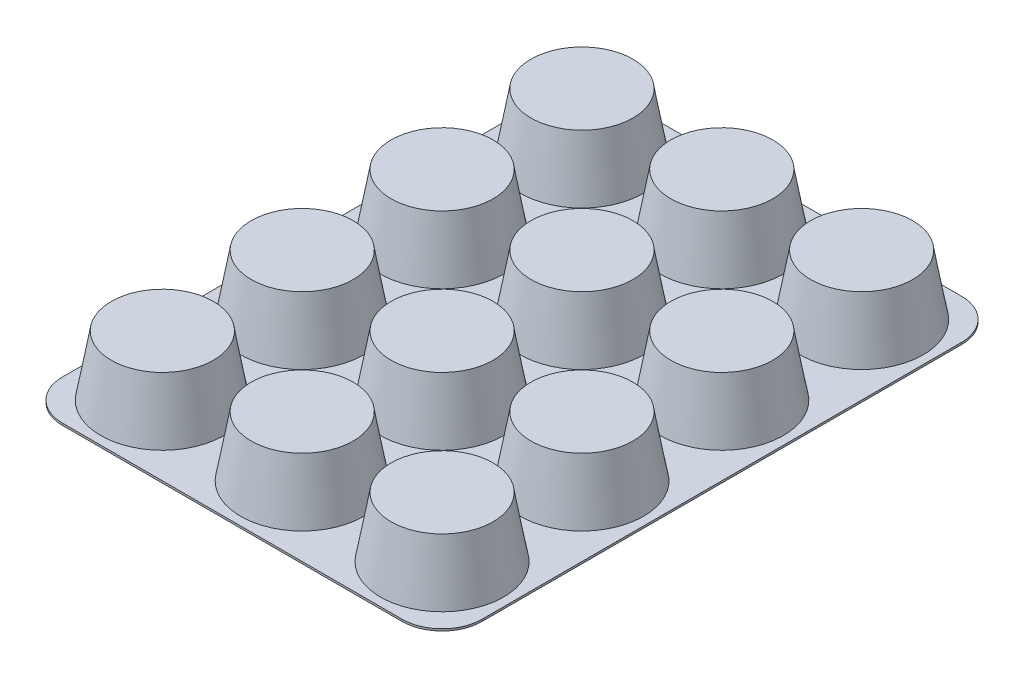
from build123d import *

# Parameters (mm, degrees)
SKETCH2_W                  = 266.7
SKETCH2_H                  = 355.6
BOSS_EXTRUDE1_DEPTH        = 1.27
SKETCH3_R                  = 39.37
BOSS_EXTRUDE2_DEPTH        = 39.37
BOSS_EXTRUDE2_DRAFT        = -10
SKETCH4_R                  = 38.1
CUT_EXTRUDE1_DEPTH         = 38.1
CUT_EXTRUDE1_DRAFT         = -10
LPATTERN3_COPY_1_SKETCH_R  = 39.37
LPATTERN3_COPY_1_DEPTH     = 39.37
LPATTERN3_COPY_1_DRAFT     = -10
LPATTERN3_COPY_2_SKETCH_R  = 39.37
LPATTERN3_COPY_2_DEPTH     = 39.37
LPATTERN3_COPY_2_DRAFT     = -10
LPATTERN3_COPY_3_SKETCH_R  = 39.37
LPATTERN3_COPY_3_DEPTH     = 39.37
LPATTERN3_COPY_3_DRAFT     = -10
LPATTERN3_COPY_4_SKETCH_R  = 39.37
LPATTERN3_COPY_4_DEPTH     = 39.37
LPATTERN3_COPY_4_DRAFT     = -10
LPATTERN3_COPY_5_SKETCH_R  = 39.37
LPATTERN3_COPY_5_DEPTH     = 39.37
LPATTERN3_COPY_5_DRAFT     = -10
LPATTERN3_COPY_6_SKETCH_R  = 39.37
LPATTERN3_COPY_6_DEPTH     = 39.37
LPATTERN3_COPY_6_DRAFT     = -10
LPATTERN3_COPY_7_SKETCH_R  = 39.37
LPATTERN3_COPY_7_DEPTH     = 39.37
LPATTERN3_COPY_7_DRAFT     = -10
LPATTERN3_COPY_8_SKETCH_R  = 39.37
LPATTERN3_COPY_8_DEPTH     = 39.37
LPATTERN3_COPY_8_DRAFT     = -10
LPATTERN3_COPY_9_SKETCH_R  = 39.37
LPATTERN3_COPY_9_DEPTH     = 39.37
LPATTERN3_COPY_9_DRAFT     = -10
LPATTERN3_COPY_10_SKETCH_R = 39.37
LPATTERN3_COPY_10_DEPTH    = 39.37
LPATTERN3_COPY_10_DRAFT    = -10
LPATTERN3_COPY_11_SKETCH_R = 39.37
LPATTERN3_COPY_11_DEPTH    = 39.37
LPATTERN3_COPY_11_DRAFT    = -10
LPATTERN3_COPY_12_SKETCH_R = 38.1
LPATTERN3_COPY_12_DEPTH    = 38.1
LPATTERN3_COPY_12_DRAFT    = -10
LPATTERN3_COPY_13_SKETCH_R = 38.1
LPATTERN3_COPY_13_DEPTH    = 38.1
LPATTERN3_COPY_13_DRAFT    = -10
LPATTERN3_COPY_14_SKETCH_R = 38.1
LPATTERN3_COPY_14_DEPTH    = 38.1
LPATTERN3_COPY_14_DRAFT    = -10
LPATTERN3_COPY_15_SKETCH_R = 38.1
LPATTERN3_COPY_15_DEPTH    = 38.1
LPATTERN3_COPY_15_DRAFT    = -10
LPATTERN3_COPY_16_SKETCH_R = 38.1
LPATTERN3_COPY_16_DEPTH    = 38.1
LPATTERN3_COPY_16_DRAFT    = -10
LPATTERN3_COPY_17_SKETCH_R = 38.1
LPATTERN3_COPY_17_DEPTH    = 38.1
LPATTERN3_COPY_17_DRAFT    = -10
LPATTERN3_COPY_18_SKETCH_R = 38.1
LPATTERN3_COPY_18_DEPTH    = 38.1
LPATTERN3_COPY_18_DRAFT    = -10
LPATTERN3_COPY_19_SKETCH_R = 38.1
LPATTERN3_COPY_19_DEPTH    = 38.1
LPATTERN3_COPY_19_DRAFT    = -10
LPATTERN3_COPY_20_SKETCH_R = 38.1
LPATTERN3_COPY_20_DEPTH    = 38.1
LPATTERN3_COPY_20_DRAFT    = -10
LPATTERN3_COPY_21_SKETCH_R = 38.1
LPATTERN3_COPY_21_DEPTH    = 38.1
LPATTERN3_COPY_21_DRAFT    = -10
LPATTERN3_COPY_22_SKETCH_R = 38.1
LPATTERN3_COPY_22_DEPTH    = 38.1
LPATTERN3_COPY_22_DRAFT    = -10
FILLET1_R                  = 25.4


with BuildPart() as part:
    # Sketch2 → Boss-Extrude1 (new body)
    with BuildSketch(Plane(origin=(0, 0, 0), x_dir=(1, 0, 0), z_dir=(0, 1, 0))):
        Rectangle(SKETCH2_W, SKETCH2_H)
    extrude(amount=BOSS_EXTRUDE1_DEPTH)


with BuildPart() as boss_extrude2_tool:
    # Sketch3 → Boss-Extrude2 (with draft: the straight prism first)
    with BuildSketch(Plane(origin=(0, 0, 0), x_dir=(-1, 0, 0), z_dir=(0, -1, 0))):
        with Locations((88.9, -133.35)):
            Circle(SKETCH3_R)
    extrude(amount=-BOSS_EXTRUDE2_DEPTH)
    # Boss-Extrude2: the draft: its side faces are tilted about the plane it starts from
    boss_extrude2_sides = [boss_extrude2_tool.faces().sort_by_distance(p)[0] for p in [
        (-49.53, 19.685, 133.35),
    ]]
    draft(boss_extrude2_sides, Plane(origin=(0, 0, 0), x_dir=(-1, 0, 0), z_dir=(0, -1, 0)), BOSS_EXTRUDE2_DRAFT)


with BuildPart() as part_1:
    add(part.part)

    # Boss-Extrude2: add boss_extrude2_tool
    add(boss_extrude2_tool.part)


with BuildPart() as cut_extrude1_tool:
    # Sketch4 → Cut-Extrude1 (with draft: the straight prism first)
    with BuildSketch(Plane(origin=(0, 0, 0), x_dir=(-1, 0, 0), z_dir=(0, -1, 0))):
        with Locations((88.9, -133.35)):
            Circle(SKETCH4_R)
    extrude(amount=-CUT_EXTRUDE1_DEPTH)
    # Cut-Extrude1: the draft: its side faces are tilted about the plane it starts from
    cut_extrude1_sides = [cut_extrude1_tool.faces().sort_by_distance(p)[0] for p in [
        (-50.8, 19.05, 133.35),
    ]]
    draft(cut_extrude1_sides, Plane(origin=(0, 0, 0), x_dir=(-1, 0, 0), z_dir=(0, -1, 0)), CUT_EXTRUDE1_DRAFT)


with BuildPart() as part_2:
    add(part_1.part)

    # Cut-Extrude1: cut by cut_extrude1_tool
    add(cut_extrude1_tool.part, mode=Mode.SUBTRACT)


with BuildPart() as lpattern3_copy_1_tool:
    # LPattern3 copy 1 sketch → LPattern3 copy 1 (with draft: the straight prism first)
    with BuildSketch(Plane(origin=(0, 0, -88.9), x_dir=(-1, 0, 0), z_dir=(0, -1, 0))):
        with Locations((88.9, -133.35)):
            Circle(LPATTERN3_COPY_1_SKETCH_R)
    extrude(amount=-LPATTERN3_COPY_1_DEPTH)
    # LPattern3 copy 1: the draft: its side faces are tilted about the plane it starts from
    lpattern3_copy_1_sides = [lpattern3_copy_1_tool.faces().sort_by_distance(p)[0] for p in [
        (-49.53, 19.685, 44.45),
    ]]
    draft(lpattern3_copy_1_sides, Plane(origin=(0, 0, -88.9), x_dir=(-1, 0, 0), z_dir=(0, -1, 0)), LPATTERN3_COPY_1_DRAFT)


with BuildPart() as part_3:
    add(part_2.part)

    # LPattern3 copy 1: add lpattern3_copy_1_tool
    add(lpattern3_copy_1_tool.part)


with BuildPart() as lpattern3_copy_2_tool:
    # LPattern3 copy 2 sketch → LPattern3 copy 2 (with draft: the straight prism first)
    with BuildSketch(Plane(origin=(0, 0, -177.8), x_dir=(-1, 0, 0), z_dir=(0, -1, 0))):
        with Locations((88.9, -133.35)):
            Circle(LPATTERN3_COPY_2_SKETCH_R)
    extrude(amount=-LPATTERN3_COPY_2_DEPTH)
    # LPattern3 copy 2: the draft: its side faces are tilted about the plane it starts from
    lpattern3_copy_2_sides = [lpattern3_copy_2_tool.faces().sort_by_distance(p)[0] for p in [
        (-49.53, 19.685, -44.45),
    ]]
    draft(lpattern3_copy_2_sides, Plane(origin=(0, 0, -177.8), x_dir=(-1, 0, 0), z_dir=(0, -1, 0)), LPATTERN3_COPY_2_DRAFT)


with BuildPart() as part_4:
    add(part_3.part)

    # LPattern3 copy 2: add lpattern3_copy_2_tool
    add(lpattern3_copy_2_tool.part)


with BuildPart() as lpattern3_copy_3_tool:
    # LPattern3 copy 3 sketch → LPattern3 copy 3 (with draft: the straight prism first)
    with BuildSketch(Plane(origin=(0, 0, -266.7), x_dir=(-1, 0, 0), z_dir=(0, -1, 0))):
        with Locations((88.9, -133.35)):
            Circle(LPATTERN3_COPY_3_SKETCH_R)
    extrude(amount=-LPATTERN3_COPY_3_DEPTH)
    # LPattern3 copy 3: the draft: its side faces are tilted about the plane it starts from
    lpattern3_copy_3_sides = [lpattern3_copy_3_tool.faces().sort_by_distance(p)[0] for p in [
        (-49.53, 19.685, -133.35),
    ]]
    draft(lpattern3_copy_3_sides, Plane(origin=(0, 0, -266.7), x_dir=(-1, 0, 0), z_dir=(0, -1, 0)), LPATTERN3_COPY_3_DRAFT)


with BuildPart() as part_5:
    add(part_4.part)

    # LPattern3 copy 3: add lpattern3_copy_3_tool
    add(lpattern3_copy_3_tool.part)


with BuildPart() as lpattern3_copy_4_tool:
    # LPattern3 copy 4 sketch → LPattern3 copy 4 (with draft: the straight prism first)
    with BuildSketch(Plane(origin=(88.9, 0, 0), x_dir=(-1, 0, 0), z_dir=(0, -1, 0))):
        with Locations((88.9, -133.35)):
            Circle(LPATTERN3_COPY_4_SKETCH_R)
    extrude(amount=-LPATTERN3_COPY_4_DEPTH)
    # LPattern3 copy 4: the draft: its side faces are tilted about the plane it starts from
    lpattern3_copy_4_sides = [lpattern3_copy_4_tool.faces().sort_by_distance(p)[0] for p in [
        (39.37, 19.685, 133.35),
    ]]
    draft(lpattern3_copy_4_sides, Plane(origin=(88.9, 0, 0), x_dir=(-1, 0, 0), z_dir=(0, -1, 0)), LPATTERN3_COPY_4_DRAFT)


with BuildPart() as part_6:
    add(part_5.part)

    # LPattern3 copy 4: add lpattern3_copy_4_tool
    add(lpattern3_copy_4_tool.part)


with BuildPart() as lpattern3_copy_5_tool:
    # LPattern3 copy 5 sketch → LPattern3 copy 5 (with draft: the straight prism first)
    with BuildSketch(Plane(origin=(88.9, 0, -88.9), x_dir=(-1, 0, 0), z_dir=(0, -1, 0))):
        with Locations((88.9, -133.35)):
            Circle(LPATTERN3_COPY_5_SKETCH_R)
    extrude(amount=-LPATTERN3_COPY_5_DEPTH)
    # LPattern3 copy 5: the draft: its side faces are tilted about the plane it starts from
    lpattern3_copy_5_sides = [lpattern3_copy_5_tool.faces().sort_by_distance(p)[0] for p in [
        (39.37, 19.685, 44.45),
    ]]
    draft(lpattern3_copy_5_sides, Plane(origin=(88.9, 0, -88.9), x_dir=(-1, 0, 0), z_dir=(0, -1, 0)), LPATTERN3_COPY_5_DRAFT)


with BuildPart() as part_7:
    add(part_6.part)

    # LPattern3 copy 5: add lpattern3_copy_5_tool
    add(lpattern3_copy_5_tool.part)


with BuildPart() as lpattern3_copy_6_tool:
    # LPattern3 copy 6 sketch → LPattern3 copy 6 (with draft: the straight prism first)
    with BuildSketch(Plane(origin=(88.9, 0, -177.8), x_dir=(-1, 0, 0), z_dir=(0, -1, 0))):
        with Locations((88.9, -133.35)):
            Circle(LPATTERN3_COPY_6_SKETCH_R)
    extrude(amount=-LPATTERN3_COPY_6_DEPTH)
    # LPattern3 copy 6: the draft: its side faces are tilted about the plane it starts from
    lpattern3_copy_6_sides = [lpattern3_copy_6_tool.faces().sort_by_distance(p)[0] for p in [
        (39.37, 19.685, -44.45),
    ]]
    draft(lpattern3_copy_6_sides, Plane(origin=(88.9, 0, -177.8), x_dir=(-1, 0, 0), z_dir=(0, -1, 0)), LPATTERN3_COPY_6_DRAFT)


with BuildPart() as part_8:
    add(part_7.part)

    # LPattern3 copy 6: add lpattern3_copy_6_tool
    add(lpattern3_copy_6_tool.part)


with BuildPart() as lpattern3_copy_7_tool:
    # LPattern3 copy 7 sketch → LPattern3 copy 7 (with draft: the straight prism first)
    with BuildSketch(Plane(origin=(88.9, 0, -266.7), x_dir=(-1, 0, 0), z_dir=(0, -1, 0))):
        with Locations((88.9, -133.35)):
            Circle(LPATTERN3_COPY_7_SKETCH_R)
    extrude(amount=-LPATTERN3_COPY_7_DEPTH)
    # LPattern3 copy 7: the draft: its side faces are tilted about the plane it starts from
    lpattern3_copy_7_sides = [lpattern3_copy_7_tool.faces().sort_by_distance(p)[0] for p in [
        (39.37, 19.685, -133.35),
    ]]
    draft(lpattern3_copy_7_sides, Plane(origin=(88.9, 0, -266.7), x_dir=(-1, 0, 0), z_dir=(0, -1, 0)), LPATTERN3_COPY_7_DRAFT)


with BuildPart() as part_9:
    add(part_8.part)

    # LPattern3 copy 7: add lpattern3_copy_7_tool
    add(lpattern3_copy_7_tool.part)


with BuildPart() as lpattern3_copy_8_tool:
    # LPattern3 copy 8 sketch → LPattern3 copy 8 (with draft: the straight prism first)
    with BuildSketch(Plane(origin=(177.8, 0, 0), x_dir=(-1, 0, 0), z_dir=(0, -1, 0))):
        with Locations((88.9, -133.35)):
            Circle(LPATTERN3_COPY_8_SKETCH_R)
    extrude(amount=-LPATTERN3_COPY_8_DEPTH)
    # LPattern3 copy 8: the draft: its side faces are tilted about the plane it starts from
    lpattern3_copy_8_sides = [lpattern3_copy_8_tool.faces().sort_by_distance(p)[0] for p in [
        (128.27, 19.685, 133.35),
    ]]
    draft(lpattern3_copy_8_sides, Plane(origin=(177.8, 0, 0), x_dir=(-1, 0, 0), z_dir=(0, -1, 0)), LPATTERN3_COPY_8_DRAFT)


with BuildPart() as part_10:
    add(part_9.part)

    # LPattern3 copy 8: add lpattern3_copy_8_tool
    add(lpattern3_copy_8_tool.part)


with BuildPart() as lpattern3_copy_9_tool:
    # LPattern3 copy 9 sketch → LPattern3 copy 9 (with draft: the straight prism first)
    with BuildSketch(Plane(origin=(177.8, 0, -88.9), x_dir=(-1, 0, 0), z_dir=(0, -1, 0))):
        with Locations((88.9, -133.35)):
            Circle(LPATTERN3_COPY_9_SKETCH_R)
    extrude(amount=-LPATTERN3_COPY_9_DEPTH)
    # LPattern3 copy 9: the draft: its side faces are tilted about the plane it starts from
    lpattern3_copy_9_sides = [lpattern3_copy_9_tool.faces().sort_by_distance(p)[0] for p in [
        (128.27, 19.685, 44.45),
    ]]
    draft(lpattern3_copy_9_sides, Plane(origin=(177.8, 0, -88.9), x_dir=(-1, 0, 0), z_dir=(0, -1, 0)), LPATTERN3_COPY_9_DRAFT)


with BuildPart() as part_11:
    add(part_10.part)

    # LPattern3 copy 9: add lpattern3_copy_9_tool
    add(lpattern3_copy_9_tool.part)


with BuildPart() as lpattern3_copy_10_tool:
    # LPattern3 copy 10 sketch → LPattern3 copy 10 (with draft: the straight prism first)
    with BuildSketch(Plane(origin=(177.8, 0, -177.8), x_dir=(-1, 0, 0), z_dir=(0, -1, 0))):
        with Locations((88.9, -133.35)):
            Circle(LPATTERN3_COPY_10_SKETCH_R)
    extrude(amount=-LPATTERN3_COPY_10_DEPTH)
    # LPattern3 copy 10: the draft: its side faces are tilted about the plane it starts from
    lpattern3_copy_10_sides = [lpattern3_copy_10_tool.faces().sort_by_distance(p)[0] for p in [
        (128.27, 19.685, -44.45),
    ]]
    draft(lpattern3_copy_10_sides, Plane(origin=(177.8, 0, -177.8), x_dir=(-1, 0, 0), z_dir=(0, -1, 0)), LPATTERN3_COPY_10_DRAFT)


with BuildPart() as part_12:
    add(part_11.part)

    # LPattern3 copy 10: add lpattern3_copy_10_tool
    add(lpattern3_copy_10_tool.part)


with BuildPart() as lpattern3_copy_11_tool:
    # LPattern3 copy 11 sketch → LPattern3 copy 11 (with draft: the straight prism first)
    with BuildSketch(Plane(origin=(177.8, 0, -266.7), x_dir=(-1, 0, 0), z_dir=(0, -1, 0))):
        with Locations((88.9, -133.35)):
            Circle(LPATTERN3_COPY_11_SKETCH_R)
    extrude(amount=-LPATTERN3_COPY_11_DEPTH)
    # LPattern3 copy 11: the draft: its side faces are tilted about the plane it starts from
    lpattern3_copy_11_sides = [lpattern3_copy_11_tool.faces().sort_by_distance(p)[0] for p in [
        (128.27, 19.685, -133.35),
    ]]
    draft(lpattern3_copy_11_sides, Plane(origin=(177.8, 0, -266.7), x_dir=(-1, 0, 0), z_dir=(0, -1, 0)), LPATTERN3_COPY_11_DRAFT)


with BuildPart() as part_13:
    add(part_12.part)

    # LPattern3 copy 11: add lpattern3_copy_11_tool
    add(lpattern3_copy_11_tool.part)


with BuildPart() as lpattern3_copy_12_tool:
    # LPattern3 copy 12 sketch → LPattern3 copy 12 (with draft: the straight prism first)
    with BuildSketch(Plane(origin=(0, 0, -88.9), x_dir=(-1, 0, 0), z_dir=(0, -1, 0))):
        with Locations((88.9, -133.35)):
            Circle(LPATTERN3_COPY_12_SKETCH_R)
    extrude(amount=-LPATTERN3_COPY_12_DEPTH)
    # LPattern3 copy 12: the draft: its side faces are tilted about the plane it starts from
    lpattern3_copy_12_sides = [lpattern3_copy_12_tool.faces().sort_by_distance(p)[0] for p in [
        (-50.8, 19.05, 44.45),
    ]]
    draft(lpattern3_copy_12_sides, Plane(origin=(0, 0, -88.9), x_dir=(-1, 0, 0), z_dir=(0, -1, 0)), LPATTERN3_COPY_12_DRAFT)


with BuildPart() as part_14:
    add(part_13.part)

    # LPattern3 copy 12: cut by lpattern3_copy_12_tool
    add(lpattern3_copy_12_tool.part, mode=Mode.SUBTRACT)


with BuildPart() as lpattern3_copy_13_tool:
    # LPattern3 copy 13 sketch → LPattern3 copy 13 (with draft: the straight prism first)
    with BuildSketch(Plane(origin=(0, 0, -177.8), x_dir=(-1, 0, 0), z_dir=(0, -1, 0))):
        with Locations((88.9, -133.35)):
            Circle(LPATTERN3_COPY_13_SKETCH_R)
    extrude(amount=-LPATTERN3_COPY_13_DEPTH)
    # LPattern3 copy 13: the draft: its side faces are tilted about the plane it starts from
    lpattern3_copy_13_sides = [lpattern3_copy_13_tool.faces().sort_by_distance(p)[0] for p in [
        (-50.8, 19.05, -44.45),
    ]]
    draft(lpattern3_copy_13_sides, Plane(origin=(0, 0, -177.8), x_dir=(-1, 0, 0), z_dir=(0, -1, 0)), LPATTERN3_COPY_13_DRAFT)


with BuildPart() as part_15:
    add(part_14.part)

    # LPattern3 copy 13: cut by lpattern3_copy_13_tool
    add(lpattern3_copy_13_tool.part, mode=Mode.SUBTRACT)


with BuildPart() as lpattern3_copy_14_tool:
    # LPattern3 copy 14 sketch → LPattern3 copy 14 (with draft: the straight prism first)
    with BuildSketch(Plane(origin=(0, 0, -266.7), x_dir=(-1, 0, 0), z_dir=(0, -1, 0))):
        with Locations((88.9, -133.35)):
            Circle(LPATTERN3_COPY_14_SKETCH_R)
    extrude(amount=-LPATTERN3_COPY_14_DEPTH)
    # LPattern3 copy 14: the draft: its side faces are tilted about the plane it starts from
    lpattern3_copy_14_sides = [lpattern3_copy_14_tool.faces().sort_by_distance(p)[0] for p in [
        (-50.8, 19.05, -133.35),
    ]]
    draft(lpattern3_copy_14_sides, Plane(origin=(0, 0, -266.7), x_dir=(-1, 0, 0), z_dir=(0, -1, 0)), LPATTERN3_COPY_14_DRAFT)


with BuildPart() as part_16:
    add(part_15.part)

    # LPattern3 copy 14: cut by lpattern3_copy_14_tool
    add(lpattern3_copy_14_tool.part, mode=Mode.SUBTRACT)


with BuildPart() as lpattern3_copy_15_tool:
    # LPattern3 copy 15 sketch → LPattern3 copy 15 (with draft: the straight prism first)
    with BuildSketch(Plane(origin=(88.9, 0, 0), x_dir=(-1, 0, 0), z_dir=(0, -1, 0))):
        with Locations((88.9, -133.35)):
            Circle(LPATTERN3_COPY_15_SKETCH_R)
    extrude(amount=-LPATTERN3_COPY_15_DEPTH)
    # LPattern3 copy 15: the draft: its side faces are tilted about the plane it starts from
    lpattern3_copy_15_sides = [lpattern3_copy_15_tool.faces().sort_by_distance(p)[0] for p in [
        (38.1, 19.05, 133.35),
    ]]
    draft(lpattern3_copy_15_sides, Plane(origin=(88.9, 0, 0), x_dir=(-1, 0, 0), z_dir=(0, -1, 0)), LPATTERN3_COPY_15_DRAFT)


with BuildPart() as part_17:
    add(part_16.part)

    # LPattern3 copy 15: cut by lpattern3_copy_15_tool
    add(lpattern3_copy_15_tool.part, mode=Mode.SUBTRACT)


with BuildPart() as lpattern3_copy_16_tool:
    # LPattern3 copy 16 sketch → LPattern3 copy 16 (with draft: the straight prism first)
    with BuildSketch(Plane(origin=(88.9, 0, -88.9), x_dir=(-1, 0, 0), z_dir=(0, -1, 0))):
        with Locations((88.9, -133.35)):
            Circle(LPATTERN3_COPY_16_SKETCH_R)
    extrude(amount=-LPATTERN3_COPY_16_DEPTH)
    # LPattern3 copy 16: the draft: its side faces are tilted about the plane it starts from
    lpattern3_copy_16_sides = [lpattern3_copy_16_tool.faces().sort_by_distance(p)[0] for p in [
        (38.1, 19.05, 44.45),
    ]]
    draft(lpattern3_copy_16_sides, Plane(origin=(88.9, 0, -88.9), x_dir=(-1, 0, 0), z_dir=(0, -1, 0)), LPATTERN3_COPY_16_DRAFT)


with BuildPart() as part_18:
    add(part_17.part)

    # LPattern3 copy 16: cut by lpattern3_copy_16_tool
    add(lpattern3_copy_16_tool.part, mode=Mode.SUBTRACT)


with BuildPart() as lpattern3_copy_17_tool:
    # LPattern3 copy 17 sketch → LPattern3 copy 17 (with draft: the straight prism first)
    with BuildSketch(Plane(origin=(88.9, 0, -177.8), x_dir=(-1, 0, 0), z_dir=(0, -1, 0))):
        with Locations((88.9, -133.35)):
            Circle(LPATTERN3_COPY_17_SKETCH_R)
    extrude(amount=-LPATTERN3_COPY_17_DEPTH)
    # LPattern3 copy 17: the draft: its side faces are tilted about the plane it starts from
    lpattern3_copy_17_sides = [lpattern3_copy_17_tool.faces().sort_by_distance(p)[0] for p in [
        (38.1, 19.05, -44.45),
    ]]
    draft(lpattern3_copy_17_sides, Plane(origin=(88.9, 0, -177.8), x_dir=(-1, 0, 0), z_dir=(0, -1, 0)), LPATTERN3_COPY_17_DRAFT)


with BuildPart() as part_19:
    add(part_18.part)

    # LPattern3 copy 17: cut by lpattern3_copy_17_tool
    add(lpattern3_copy_17_tool.part, mode=Mode.SUBTRACT)


with BuildPart() as lpattern3_copy_18_tool:
    # LPattern3 copy 18 sketch → LPattern3 copy 18 (with draft: the straight prism first)
    with BuildSketch(Plane(origin=(88.9, 0, -266.7), x_dir=(-1, 0, 0), z_dir=(0, -1, 0))):
        with Locations((88.9, -133.35)):
            Circle(LPATTERN3_COPY_18_SKETCH_R)
    extrude(amount=-LPATTERN3_COPY_18_DEPTH)
    # LPattern3 copy 18: the draft: its side faces are tilted about the plane it starts from
    lpattern3_copy_18_sides = [lpattern3_copy_18_tool.faces().sort_by_distance(p)[0] for p in [
        (38.1, 19.05, -133.35),
    ]]
    draft(lpattern3_copy_18_sides, Plane(origin=(88.9, 0, -266.7), x_dir=(-1, 0, 0), z_dir=(0, -1, 0)), LPATTERN3_COPY_18_DRAFT)


with BuildPart() as part_20:
    add(part_19.part)

    # LPattern3 copy 18: cut by lpattern3_copy_18_tool
    add(lpattern3_copy_18_tool.part, mode=Mode.SUBTRACT)


with BuildPart() as lpattern3_copy_19_tool:
    # LPattern3 copy 19 sketch → LPattern3 copy 19 (with draft: the straight prism first)
    with BuildSketch(Plane(origin=(177.8, 0, 0), x_dir=(-1, 0, 0), z_dir=(0, -1, 0))):
        with Locations((88.9, -133.35)):
            Circle(LPATTERN3_COPY_19_SKETCH_R)
    extrude(amount=-LPATTERN3_COPY_19_DEPTH)
    # LPattern3 copy 19: the draft: its side faces are tilted about the plane it starts from
    lpattern3_copy_19_sides = [lpattern3_copy_19_tool.faces().sort_by_distance(p)[0] for p in [
        (127, 19.05, 133.35),
    ]]
    draft(lpattern3_copy_19_sides, Plane(origin=(177.8, 0, 0), x_dir=(-1, 0, 0), z_dir=(0, -1, 0)), LPATTERN3_COPY_19_DRAFT)


with BuildPart() as part_21:
    add(part_20.part)

    # LPattern3 copy 19: cut by lpattern3_copy_19_tool
    add(lpattern3_copy_19_tool.part, mode=Mode.SUBTRACT)


with BuildPart() as lpattern3_copy_20_tool:
    # LPattern3 copy 20 sketch → LPattern3 copy 20 (with draft: the straight prism first)
    with BuildSketch(Plane(origin=(177.8, 0, -88.9), x_dir=(-1, 0, 0), z_dir=(0, -1, 0))):
        with Locations((88.9, -133.35)):
            Circle(LPATTERN3_COPY_20_SKETCH_R)
    extrude(amount=-LPATTERN3_COPY_20_DEPTH)
    # LPattern3 copy 20: the draft: its side faces are tilted about the plane it starts from
    lpattern3_copy_20_sides = [lpattern3_copy_20_tool.faces().sort_by_distance(p)[0] for p in [
        (127, 19.05, 44.45),
    ]]
    draft(lpattern3_copy_20_sides, Plane(origin=(177.8, 0, -88.9), x_dir=(-1, 0, 0), z_dir=(0, -1, 0)), LPATTERN3_COPY_20_DRAFT)


with BuildPart() as part_22:
    add(part_21.part)

    # LPattern3 copy 20: cut by lpattern3_copy_20_tool
    add(lpattern3_copy_20_tool.part, mode=Mode.SUBTRACT)


with BuildPart() as lpattern3_copy_21_tool:
    # LPattern3 copy 21 sketch → LPattern3 copy 21 (with draft: the straight prism first)
    with BuildSketch(Plane(origin=(177.8, 0, -177.8), x_dir=(-1, 0, 0), z_dir=(0, -1, 0))):
        with Locations((88.9, -133.35)):
            Circle(LPATTERN3_COPY_21_SKETCH_R)
    extrude(amount=-LPATTERN3_COPY_21_DEPTH)
    # LPattern3 copy 21: the draft: its side faces are tilted about the plane it starts from
    lpattern3_copy_21_sides = [lpattern3_copy_21_tool.faces().sort_by_distance(p)[0] for p in [
        (127, 19.05, -44.45),
    ]]
    draft(lpattern3_copy_21_sides, Plane(origin=(177.8, 0, -177.8), x_dir=(-1, 0, 0), z_dir=(0, -1, 0)), LPATTERN3_COPY_21_DRAFT)


with BuildPart() as part_23:
    add(part_22.part)

    # LPattern3 copy 21: cut by lpattern3_copy_21_tool
    add(lpattern3_copy_21_tool.part, mode=Mode.SUBTRACT)


with BuildPart() as lpattern3_copy_22_tool:
    # LPattern3 copy 22 sketch → LPattern3 copy 22 (with draft: the straight prism first)
    with BuildSketch(Plane(origin=(177.8, 0, -266.7), x_dir=(-1, 0, 0), z_dir=(0, -1, 0))):
        with Locations((88.9, -133.35)):
            Circle(LPATTERN3_COPY_22_SKETCH_R)
    extrude(amount=-LPATTERN3_COPY_22_DEPTH)
    # LPattern3 copy 22: the draft: its side faces are tilted about the plane it starts from
    lpattern3_copy_22_sides = [lpattern3_copy_22_tool.faces().sort_by_distance(p)[0] for p in [
        (127, 19.05, -133.35),
    ]]
    draft(lpattern3_copy_22_sides, Plane(origin=(177.8, 0, -266.7), x_dir=(-1, 0, 0), z_dir=(0, -1, 0)), LPATTERN3_COPY_22_DRAFT)


with BuildPart() as part_24:
    add(part_23.part)

    # LPattern3 copy 22: cut by lpattern3_copy_22_tool
    add(lpattern3_copy_22_tool.part, mode=Mode.SUBTRACT)

    # Fillet1
    fillet1_edges = [part_24.edges().sort_by_distance(p)[0] for p in [
        (133.35, 0.635, 177.8),
        (-133.35, 0.635, 177.8),
        (-133.35, 0.635, -177.8),
        (133.35, 0.635, -177.8),
    ]]
    fillet(fillet1_edges, radius=FILLET1_R)


solid = part_24.part
